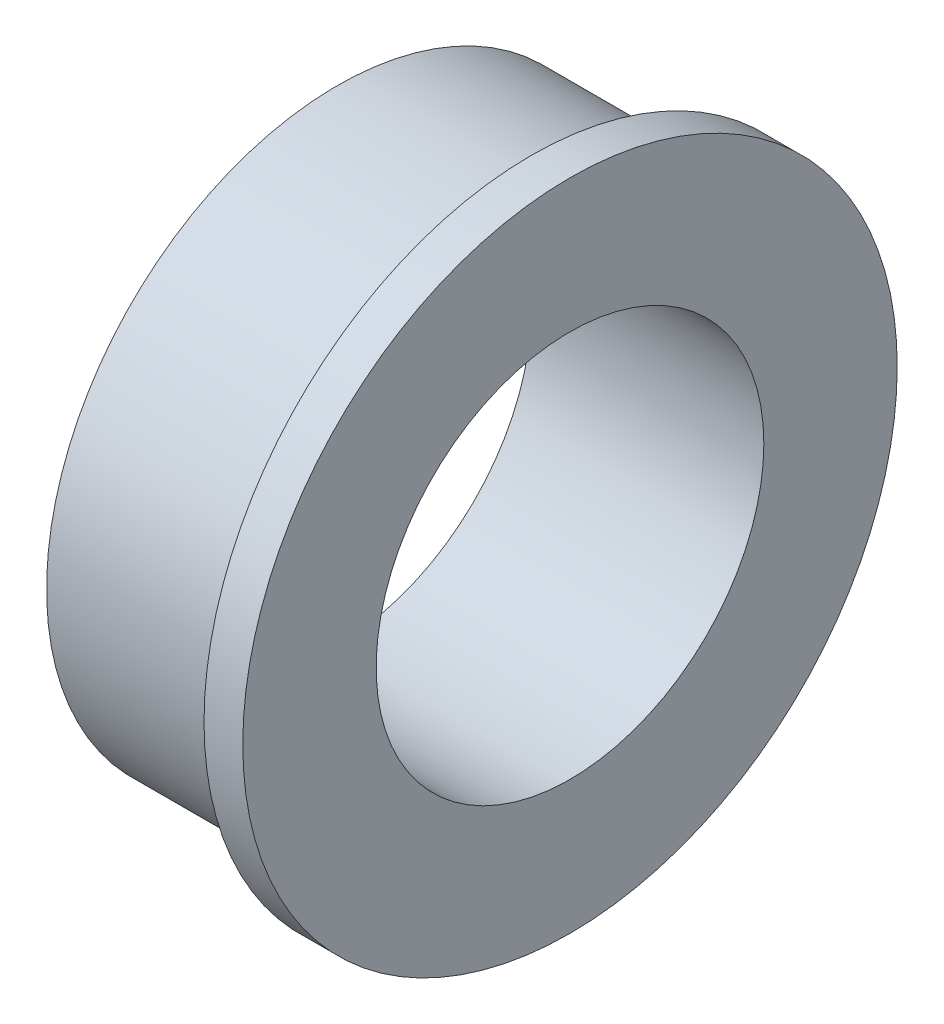
from build123d import *

# Parameters (mm, degrees)
SKETCH1_R           = 4.7625
SKETCH1_R_2         = 3.175
BOSS_EXTRUDE1_DEPTH = 3.175
SKETCH2_R           = 5.3594
SKETCH2_R_2         = 3.175
BOSS_EXTRUDE2_DEPTH = 0.635


with BuildPart() as part:
    # Sketch1 → Boss-Extrude1 (new body)
    with BuildSketch(Plane(origin=(0, 0, 0), x_dir=(0, 0, -1), z_dir=(1, 0, 0))):
        Circle(SKETCH1_R)
        Circle(SKETCH1_R_2, mode=Mode.SUBTRACT)
    extrude(amount=BOSS_EXTRUDE1_DEPTH)

    # Sketch2 → Boss-Extrude2 (add)
    with BuildSketch(Plane(origin=(3.175, 0, 0), x_dir=(0, 0, -1), z_dir=(1, 0, 0))):
        Circle(SKETCH2_R)
        Circle(SKETCH2_R_2, mode=Mode.SUBTRACT)
    extrude(amount=BOSS_EXTRUDE2_DEPTH)


solid = part.part
